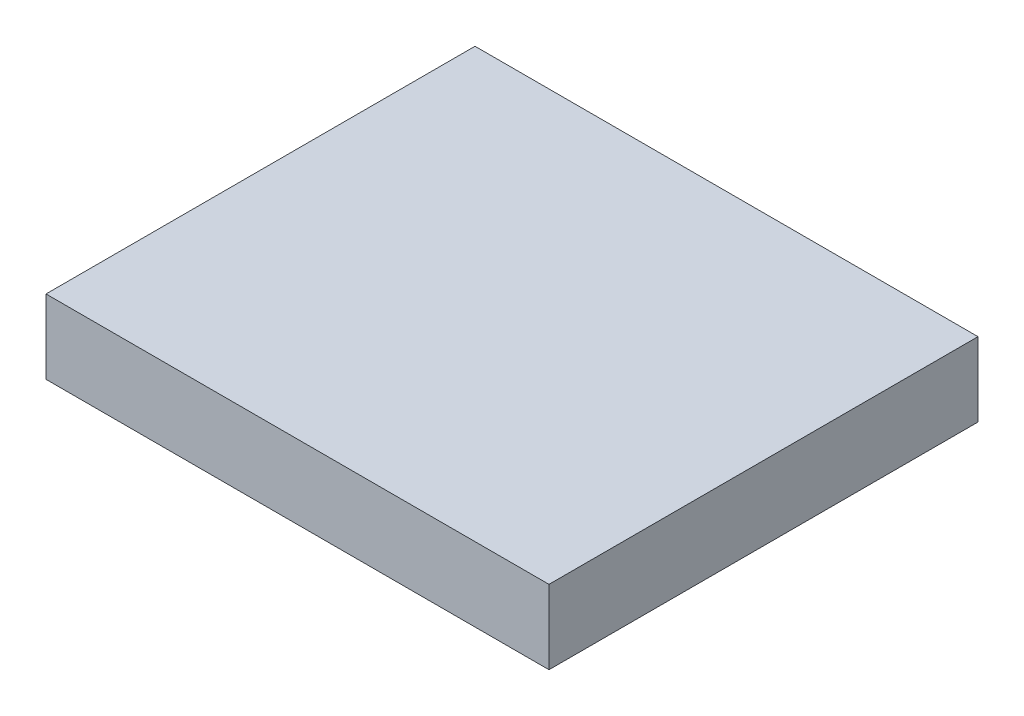
from build123d import *

# Parameters (mm, degrees)
SKETCH1_W           = 34
SKETCH1_H           = 29
BOSS_EXTRUDE1_DEPTH = 5


with BuildPart() as part:
    # Sketch1 → Boss-Extrude1 (new body)
    with BuildSketch(Plane(origin=(0, 0, 0), x_dir=(1, 0, 0), z_dir=(0, 1, 0))):
        Rectangle(SKETCH1_W, SKETCH1_H)
    extrude(amount=BOSS_EXTRUDE1_DEPTH)


solid = part.part
